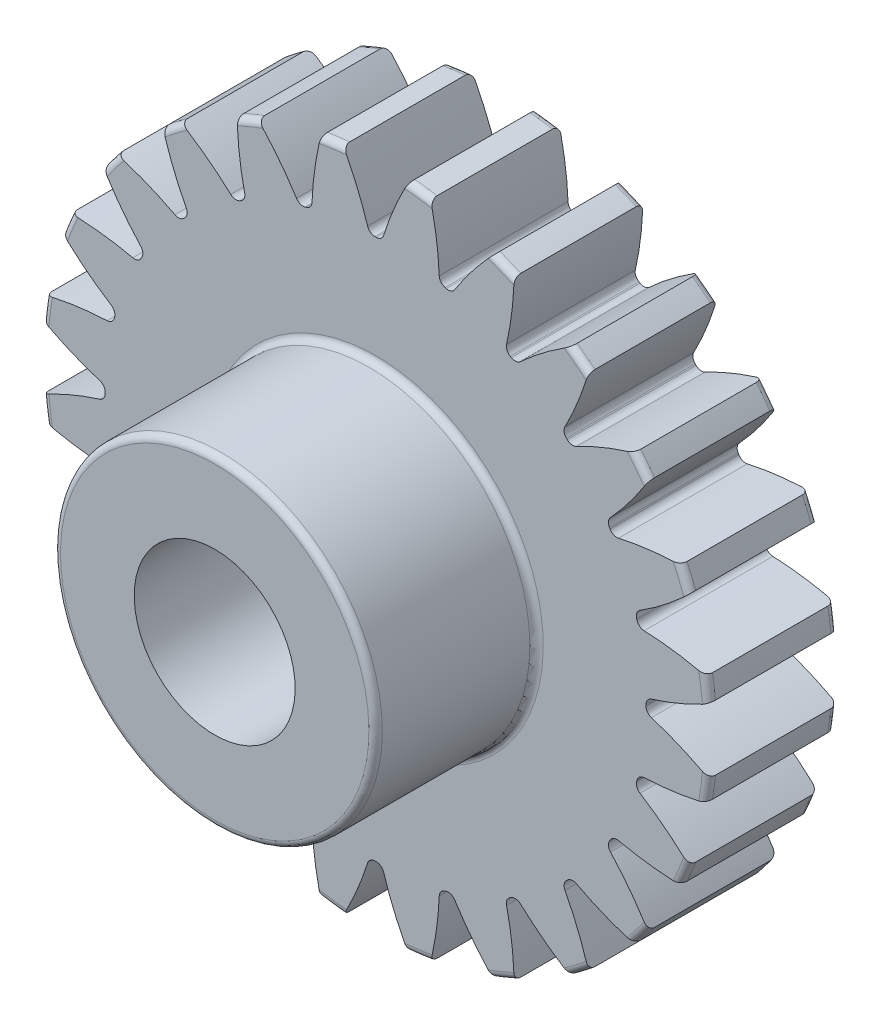
from build123d import *

# Parameters (mm, degrees)
FILLET2_R          = 0.208
CUT_EXTRUDE2_DEPTH = 16.534477949
CIRPATTERN1_COUNT  = 24


with BuildPart() as part:
    # Sketch4 → Revolve1 (revolve)
    with BuildSketch(Plane(origin=(0, 0, 0), x_dir=(0, 0, -1), z_dir=(1, 0, 0))):
        Polygon((-9, 2.5), (-9, 5), (-4, 5), (-4, 10.4), (0, 10.4), (0, 2.5), align=None)
    revolve(axis=Axis((0, 0, 4), (0, 0, 1)))

    # Fillet2
    fillet2_edges = [part.edges().sort_by_distance(p)[0] for p in [
        (0, -10.4, 0),
        (0, -10.4, 4),
        (0, -5, 4),
        (0, -5, 9),
    ]]
    fillet(fillet2_edges, radius=FILLET2_R)

    # Sketch7 → Cut-Extrude2 (cut, through all)
    with BuildSketch(Plane.XY.offset(4)):
        with BuildLine():
            ThreePointArc((-0.019666143, 8.399976979), (0, 8.4), (0.019666143, 8.399976979))
            ThreePointArc((0.019666143, 8.399976979), (0.162256304, 8.44650899), (0.249381714, 8.568600534))
            ThreePointArc((0.249381714, 8.568600534), (0.584342261, 9.478971984), (1.009464419, 10.350892792))
            ThreePointArc((1.009464419, 10.350892792), (0, 10.4), (-1.009464419, 10.350892792))
            ThreePointArc((-1.009464419, 10.350892792), (-0.584342261, 9.478971984), (-0.249381714, 8.568600534))
            ThreePointArc((-0.249381714, 8.568600534), (-0.162256304, 8.44650899), (-0.019666143, 8.399976979))
        make_face()
    cut_extrude2 = extrude(amount=-CUT_EXTRUDE2_DEPTH, mode=Mode.SUBTRACT)

    # CirPattern1: Cut-Extrude2 ×24 about axis
    cirpattern1_axis = Axis((0, 0, 0), (0, 0, 1))
    for i in range(1, CIRPATTERN1_COUNT):
        add(cut_extrude2.rotate(cirpattern1_axis, i * 360 / CIRPATTERN1_COUNT), mode=Mode.SUBTRACT)


solid = part.part
